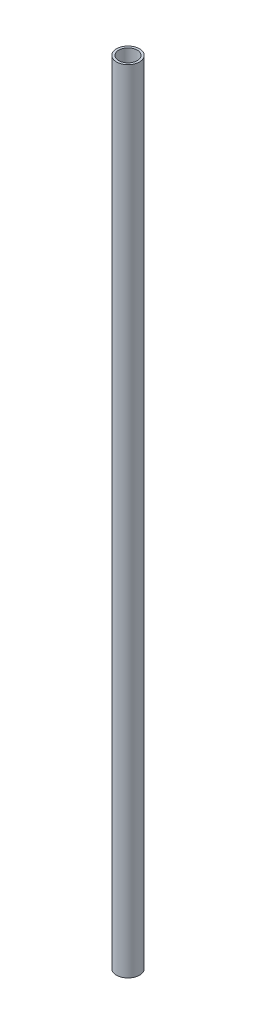
from build123d import *

# Parameters (mm, degrees)
SKETCH1_R           = 6.35
SKETCH1_R_2         = 5.1054
BOSS_EXTRUDE1_DEPTH = 438.15


with BuildPart() as part:
    # Sketch1 → Boss-Extrude1 (new body)
    with BuildSketch(Plane(origin=(0, 0, 0), x_dir=(1, 0, 0), z_dir=(0, 1, 0))):
        with Locations(Location((0, 0, 0), (0, 0, 270))):
            Circle(SKETCH1_R)
        with Locations(Location((0, 0, 0), (0, 0, 270))):
            Circle(SKETCH1_R_2, mode=Mode.SUBTRACT)
    extrude(amount=BOSS_EXTRUDE1_DEPTH)


solid = part.part
